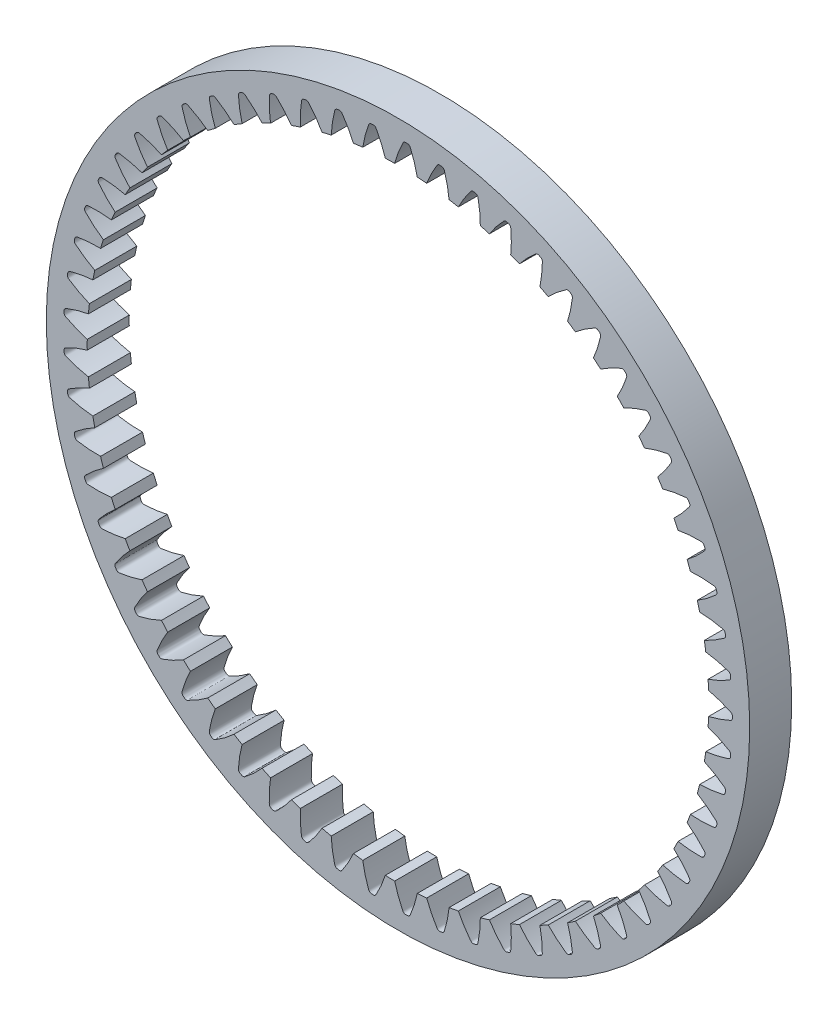
from build123d import *

# Parameters (mm, degrees)
SKETCHREVOLVESPURGEAR_W       = 4
SKETCHREVOLVESPURGEAR_H       = 3.899999985
TOOTHEXTRUDECUTSPURGEAR_DEPTH = 2
PATTERNSPURGEAR_COUNT         = 61


with BuildPart() as part:
    # SketchRevolveSpurGear → SpurGear (revolve)
    with BuildSketch(Plane(origin=(0, 0, 0), x_dir=(0, 0, -1), z_dir=(1, 0, 0)), mode=Mode.PRIVATE) as spurgear_sk:
        with Locations((0, 31.54999955)):
            Rectangle(SKETCHREVOLVESPURGEAR_W, SKETCHREVOLVESPURGEAR_H)
    revolve(spurgear_sk.sketch.rotate(Axis((0, 0, 0), (0, 0, -1)), 90), axis=Axis((0, 0, 0), (0, 0, -1)))

    # SketchToothSpurGear → ToothExtrudeCutSpurGear (cut, symmetric)
    with BuildSketch(Plane.XY):
        with BuildLine():
            ThreePointArc((29.561899965, -1.079326439), (29.581596899, 0), (29.561899965, 1.079326439))
            add(Edge.make_bspline(
                [(29.561899965, 1.079326439), (29.673195227, 1.055167196), (29.845740062, 1.013527141), (30.082458484, 0.948562023), (30.277981813, 0.890358107), (30.484835794, 0.823900708), (30.70276782, 0.748717332), (30.931419832, 0.66413836), (31.170776455, 0.570335147), (31.41935673, 0.464128559), (31.603637048, 0.388007897), (31.713618985, 0.331288205), (31.748059448, 0.304877742), (31.77824591, 0.274521602), (31.803778594, 0.240105081), (31.82413073, 0.202423459), (31.84390805, 0.149420693), (31.850751828, 0.093781483), (31.849815044, 0.039561756), (31.850091763, 0), (31.849815044, -0.039561756), (31.850751828, -0.093781483), (31.84390805, -0.149420693), (31.82413073, -0.202423459), (31.803778594, -0.240105081), (31.77824591, -0.274521602), (31.748059448, -0.304877742), (31.713618985, -0.331288205), (31.603637048, -0.388007897), (31.41935673, -0.464128559), (31.170776455, -0.570335147), (30.931419832, -0.66413836), (30.70276782, -0.748717332), (30.484835794, -0.823900708), (30.277981813, -0.890358107), (30.082458484, -0.948562023), (29.845740062, -1.013527141), (29.673195227, -1.055167196), (29.561899965, -1.079326439)],
                knots=[0, 0, 0, 0, 0.064236715, 0.100096133, 0.13844959, 0.179297087, 0.222638623, 0.2684742, 0.316803816, 0.367627472, 0.420945168, 0.429252061, 0.437279486, 0.445306911, 0.453334337, 0.461361762, 0.469389187, 0.485125926, 0.492562969, 0.5, 0.507437031, 0.514874074, 0.530610813, 0.538638238, 0.546665663, 0.554693089, 0.562720514, 0.570747939, 0.579054832, 0.632372528, 0.683196184, 0.7315258, 0.777361377, 0.820702913, 0.86155041, 0.899903867, 0.935763285, 1, 1, 1, 1], degree=3))
        make_face()
    toothextrudecutspurgear = extrude(amount=TOOTHEXTRUDECUTSPURGEAR_DEPTH, both=True, mode=Mode.SUBTRACT)

    # PatternSpurGear: ToothExtrudeCutSpurGear ×61 about axis
    patternspurgear_axis = Axis((0, 0, 55), (0, 0, -1))
    for i in range(1, PATTERNSPURGEAR_COUNT):
        add(toothextrudecutspurgear.rotate(patternspurgear_axis, i * 360 / PATTERNSPURGEAR_COUNT), mode=Mode.SUBTRACT)


solid = part.part
